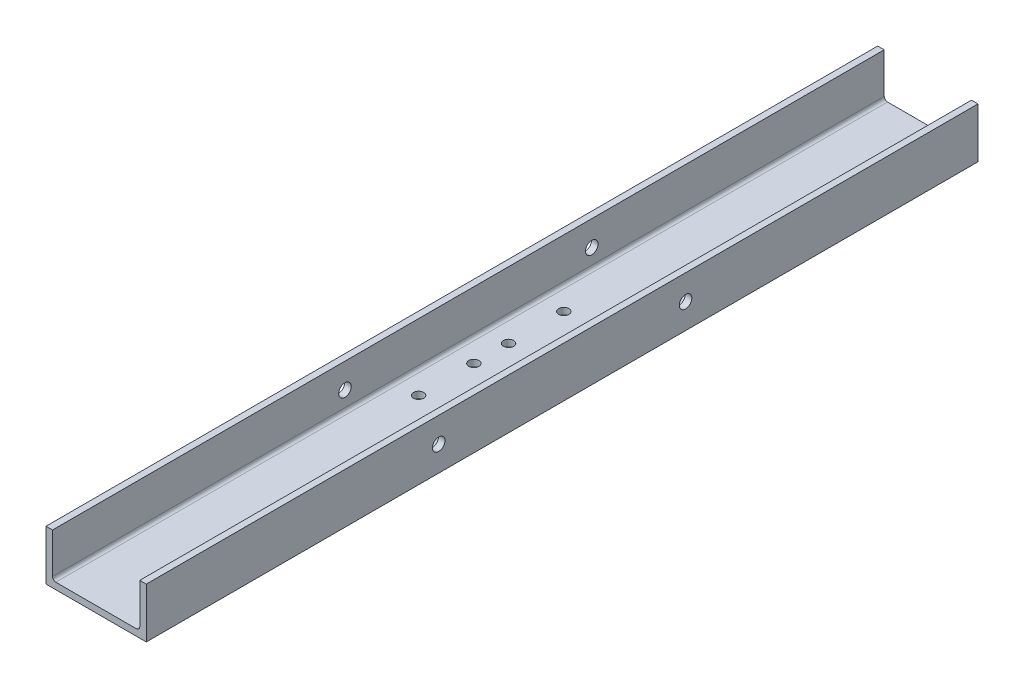
from build123d import *

# Parameters (mm, degrees)
BOSS_EXTRUDE1_DEPTH = 210.695
FILLET1_R           = 1.651
SKETCH4_R           = 2.585
CUT_EXTRUDE1_DEPTH  = 10
SKETCH9_R           = 3.18
CUT_EXTRUDE2_DEPTH  = 30


with BuildPart() as part:
    # Sketch3 → Boss-Extrude1 (new, symmetric)
    with BuildSketch(Plane.XY):
        Polygon((-25.4, 12.7), (-25.4, -12.7), (25.4, -12.7), (25.4, 12.7), (22.098, 12.7), (22.098, -9.398), (-22.098, -9.398), (-22.098, 12.7), align=None)
    extrude(amount=BOSS_EXTRUDE1_DEPTH, both=True)

    # Fillet1
    fillet1_edges = [part.edges().sort_by_distance(p)[0] for p in [
        (-22.098, -9.398, 0),
        (22.098, -9.398, 0),
    ]]
    fillet(fillet1_edges, radius=FILLET1_R)

    # Sketch4 → Cut-Extrude1 (cut)
    with BuildSketch(Plane(origin=(0, -9.398, 0), x_dir=(1, 0, 0), z_dir=(0, 1, 0))):
        with Locations(Location((-10.530435142, 8.79, 0), (0, 0, 180))):
            Circle(SKETCH4_R)
        with Locations(Location((10.469564858, 8.79, 0), (0, 0, 180))):
            Circle(SKETCH4_R)
        with Locations(Location((-10.530435142, 36.79, 0), (0, 0, 180))):
            Circle(SKETCH4_R)
        with Locations(Location((10.469564858, 36.79, 0), (0, 0, 180))):
            Circle(SKETCH4_R)
        with Locations(Location((-10.530435142, -36.79, 0), (0, 0, 180))):
            Circle(SKETCH4_R)
        with Locations(Location((10.469564858, -36.79, 0), (0, 0, 180))):
            Circle(SKETCH4_R)
        with Locations(Location((10.469564858, -8.79, 0), (0, 0, 180))):
            Circle(SKETCH4_R)
        with Locations(Location((-10.530435142, -8.79, 0), (0, 0, 180))):
            Circle(SKETCH4_R)
    extrude(amount=-CUT_EXTRUDE1_DEPTH, mode=Mode.SUBTRACT)

    # Sketch9 → Cut-Extrude2 (cut, symmetric)
    with BuildSketch(Plane(origin=(0, 0, 0), x_dir=(0, 0, -1), z_dir=(1, 0, 0))):
        with Locations(Location((-62.52, 0, 0), (0, 0, 270))):
            Circle(SKETCH9_R)
        with Locations(Location((62.52, 0, 0), (0, 0, 270))):
            Circle(SKETCH9_R)
    extrude(amount=CUT_EXTRUDE2_DEPTH, both=True, mode=Mode.SUBTRACT)


solid = part.part
